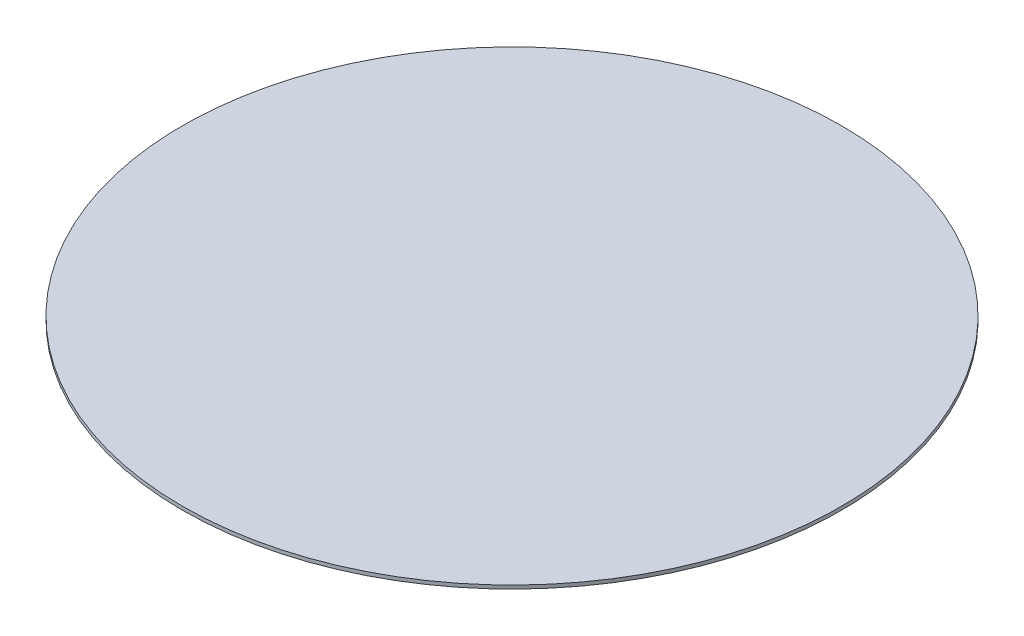
from build123d import *

# Parameters (mm, degrees)
SKETCH1_R           = 149.225
BOSS_EXTRUDE1_DEPTH = 1.5875


with BuildPart() as part:
    # Sketch1 → Boss-Extrude1 (new body)
    with BuildSketch(Plane(origin=(0, 0, 0), x_dir=(1, 0, 0), z_dir=(0, 1, 0))):
        with Locations(Location((0, 0, 0), (0, 0, 270))):
            Circle(SKETCH1_R)
    extrude(amount=BOSS_EXTRUDE1_DEPTH)


solid = part.part
